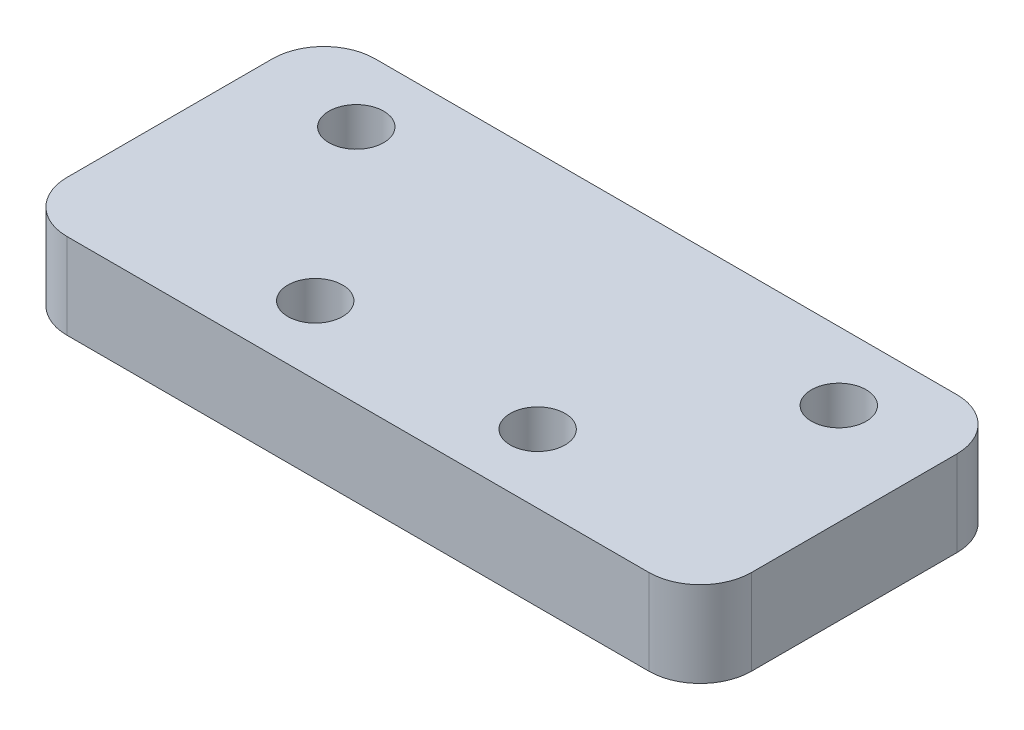
from build123d import *

# Parameters (mm, degrees)
SKETCH2_W           = 40
SKETCH2_H           = 18
SKETCH2_R           = 1.6
BOSS_EXTRUDE1_DEPTH = 5
FILLET1_R           = 3


with BuildPart() as part:
    # Sketch2 → Boss-Extrude1 (new body)
    with BuildSketch(Plane(origin=(0, 0, 0), x_dir=(1, 0, 0), z_dir=(0, 1, 0))):
        with Locations((20, 9)):
            Rectangle(SKETCH2_W, SKETCH2_H)
        with Locations(Location((5.9, 14, 0), (0, 0, 270))):
            Circle(SKETCH2_R, mode=Mode.SUBTRACT)
        with Locations(Location((34.1, 14, 0), (0, 0, 270))):
            Circle(SKETCH2_R, mode=Mode.SUBTRACT)
        with Locations(Location((13.5, 4, 0), (0, 0, 270))):
            Circle(SKETCH2_R, mode=Mode.SUBTRACT)
        with Locations(Location((26.5, 4, 0), (0, 0, 270))):
            Circle(SKETCH2_R, mode=Mode.SUBTRACT)
    extrude(amount=BOSS_EXTRUDE1_DEPTH)

    # Fillet1
    fillet1_edges = [part.edges().sort_by_distance(p)[0] for p in [
        (0, 2.5, -18),
        (40, 2.5, -18),
        (40, 2.5, 0),
        (0, 2.5, 0),
    ]]
    fillet(fillet1_edges, radius=FILLET1_R)


solid = part.part
